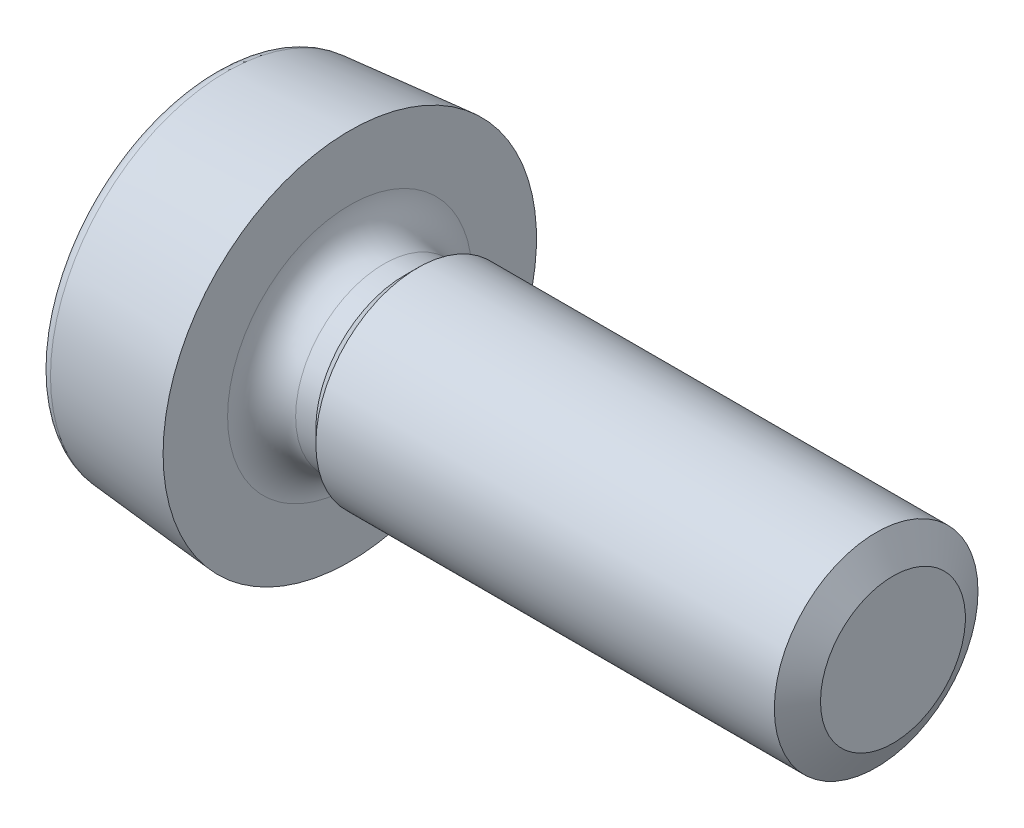
from build123d import *

# Parameters (mm, degrees)
PATTERN_CIRCULAR_1_COUNT = 2
PATTERN_CIRCULAR_1_ANGLE = 90


with BuildPart() as part:
    # 草图3 → Revolve 850 (revolve)
    with BuildSketch(Plane.XY, mode=Mode.PRIVATE) as revolve_850_sk:
        with BuildLine():
            Line((0, 0), (10, 0))
            Line((10, 0), (10, 1.5))
            Line((10, 1.5), (3, 1.5))
            Line((3, 1.5), (2.799, 1.299))
            Line((2.799, 1.299), (2.501, 1.299))
            ThreePointArc((2.501, 1.299), (2.146739503, 1.445739503), (2, 1.8))
            Line((2, 1.8), (2, 2.75))
            Line((2, 2.75), (0.182568851, 2.590995378))
            ThreePointArc((0.182568851, 2.590995378), (0.052544533, 2.52687448), (0, 2.391756438))
            Line((0, 2.391756438), (0, 0))
        make_face()
    revolve(revolve_850_sk.sketch.rotate(Axis((-2.16958059, 0, 0), (1, 0, 0)), 90), axis=Axis((-2.16958059, 0, 0), (1, 0, 0)))

    # 草图4 → 切除-旋转1 (revolve, cut)
    with BuildSketch(Plane.XY, mode=Mode.PRIVATE) as cut_revolve_1_sk:
        Polygon((9.752708003, 1.5), (10.252708003, 1.5), (10, 1.067), align=None)
    revolve(cut_revolve_1_sk.sketch.rotate(Axis((-0.21798541, 0, 0), (1, 0, 0)), 90), axis=Axis((-0.21798541, 0, 0), (1, 0, 0)), mode=Mode.SUBTRACT)

    # 草图5 → 切除-放样1 section 0
    with BuildSketch(Plane.ZY, mode=Mode.PRIVATE) as loft_1_s0:
        with BuildLine():
            Line((-0.25, 1.75), (0.25, 1.75))
            Line((0.25, 1.75), (0.25, -1.75))
            Line((0.25, -1.75), (-0.25, -1.75))
            Line((-0.25, -1.75), (-0.25, 1.75))
        make_face()
    loft_1 = loft([loft_1_s0.sketch, Vertex(0.86, 0, 0)], mode=Mode.SUBTRACT)

    # 阵列(圆周)1: 切除-放样1 ×2 about axis
    pattern_circular_1_axis = Axis((0, 0, 0), (1, 0, 0))
    for i in range(1, PATTERN_CIRCULAR_1_COUNT):
        add(loft_1.rotate(pattern_circular_1_axis, i * PATTERN_CIRCULAR_1_ANGLE / (PATTERN_CIRCULAR_1_COUNT - 1)), mode=Mode.SUBTRACT)


solid = part.part
